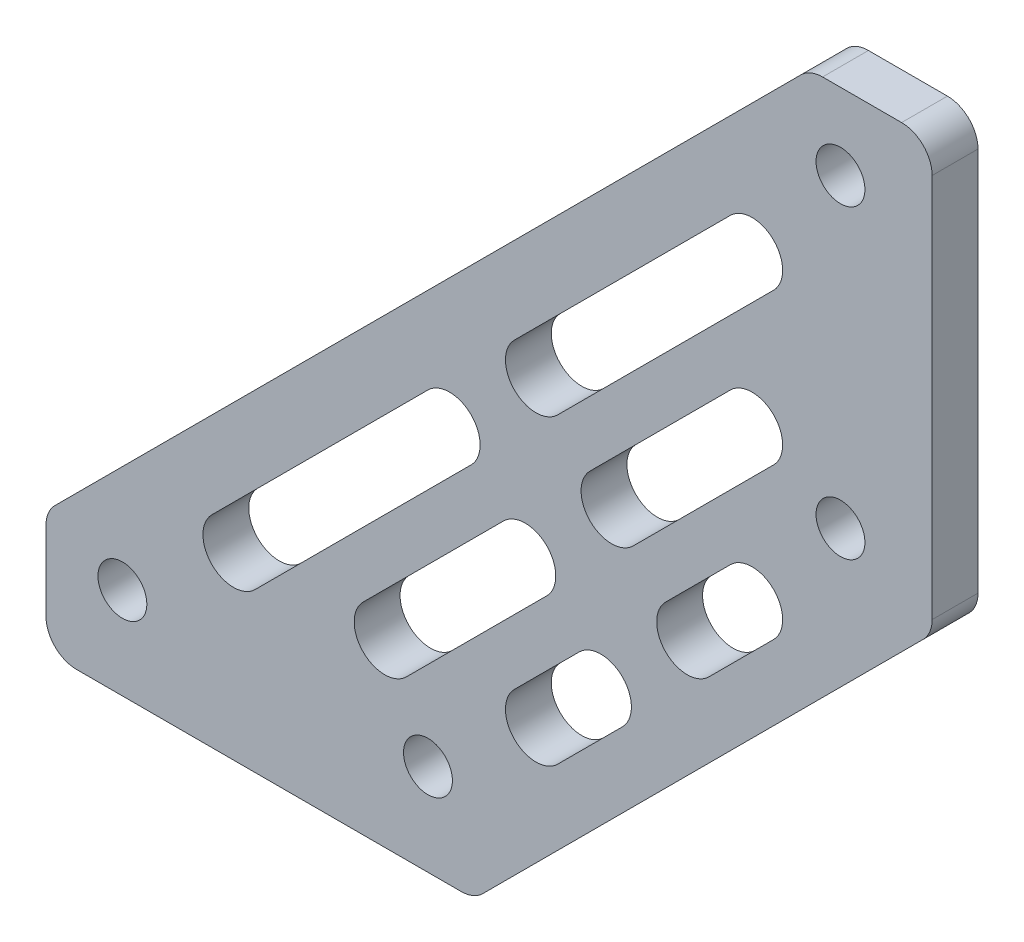
from build123d import *

# Parameters (mm, degrees)
SKETCH_1_R          = 1.6
EXTRUDE_1_DEPTH     = 3
FILLET_1_R          = 2
CUT_EXTRUDE_1_DEPTH = 10


with BuildPart() as part:
    # 草图1 → 凸台-拉伸1 (new body)
    with BuildSketch(Plane.XY):
        Polygon((0, 0), (28, 0), (58, 30), (58, 58), (50, 58), (0, 8), align=None)
        with Locations((5, 6)):
            Circle(SKETCH_1_R, mode=Mode.SUBTRACT)
        with Locations((25, 6)):
            Circle(SKETCH_1_R, mode=Mode.SUBTRACT)
        with Locations(Location((52, 53, 0), (0, 0, 180))):
            Circle(SKETCH_1_R, mode=Mode.SUBTRACT)
        with Locations(Location((52, 33, 0), (0, 0, 180))):
            Circle(SKETCH_1_R, mode=Mode.SUBTRACT)
    extrude(amount=EXTRUDE_1_DEPTH)

    # 圆角1
    fillet_1_edges = [part.edges().sort_by_distance(p)[0] for p in [
        (0, 8, 1.5),
        (50, 58, 1.5),
        (58, 58, 1.5),
        (58, 30, 1.5),
        (28, 0, 1.5),
        (0, 0, 1.5),
    ]]
    fillet(fillet_1_edges, radius=FILLET_1_R)

    # 草图2 → 切除-拉伸1 (cut)
    with BuildSketch(Plane.XY.offset(3)):
        with BuildLine():
            Line((10.857864376, 13.201010127), (25, 27.343145751))
            ThreePointArc((25, 27.343145751), (27.828427125, 27.343145751), (27.828427125, 24.514718626))
            Line((27.828427125, 24.514718626), (13.686291501, 10.372583002))
            ThreePointArc((13.686291501, 10.372583002), (10.857864376, 10.372583002), (10.857864376, 13.201010127))
        make_face()
        with BuildLine():
            Line((32.778174593, 19.564971157), (23.585786438, 10.372583002))
            ThreePointArc((23.585786438, 10.372583002), (20.757359313, 10.372583002), (20.757359313, 13.201010127))
            Line((20.757359313, 13.201010127), (29.949747468, 22.393398282))
            ThreePointArc((29.949747468, 22.393398282), (32.778174593, 22.393398282), (32.778174593, 19.564971157))
        make_face()
        with BuildLine():
            Line((30.656854249, 13.201010127), (34.899494937, 17.443650814))
            ThreePointArc((34.899494937, 17.443650814), (37.727922061, 17.443650814), (37.727922061, 14.615223689))
            Line((37.727922061, 14.615223689), (33.485281374, 10.372583002))
            ThreePointArc((33.485281374, 10.372583002), (30.656854249, 10.372583002), (30.656854249, 13.201010127))
        make_face()
        with BuildLine():
            Line((44.798989873, 47.142135624), (30.656854249, 33))
            ThreePointArc((30.656854249, 33), (30.656854249, 30.171572875), (33.485281374, 30.171572875))
            Line((33.485281374, 30.171572875), (47.627416998, 44.313708499))
            ThreePointArc((47.627416998, 44.313708499), (47.627416998, 47.142135624), (44.798989873, 47.142135624))
        make_face()
        with BuildLine():
            Line((38.435028843, 25.221825407), (47.627416998, 34.414213562))
            ThreePointArc((47.627416998, 34.414213562), (47.627416998, 37.242640687), (44.798989873, 37.242640687))
            Line((44.798989873, 37.242640687), (35.606601718, 28.050252532))
            ThreePointArc((35.606601718, 28.050252532), (35.606601718, 25.221825407), (38.435028843, 25.221825407))
        make_face()
        with BuildLine():
            Line((44.798989873, 27.343145751), (40.556349186, 23.100505063))
            ThreePointArc((40.556349186, 23.100505063), (40.556349186, 20.272077939), (43.384776311, 20.272077939))
            Line((43.384776311, 20.272077939), (47.627416998, 24.514718626))
            ThreePointArc((47.627416998, 24.514718626), (47.627416998, 27.343145751), (44.798989873, 27.343145751))
        make_face()
    extrude(amount=-CUT_EXTRUDE_1_DEPTH, mode=Mode.SUBTRACT)


solid = part.part
